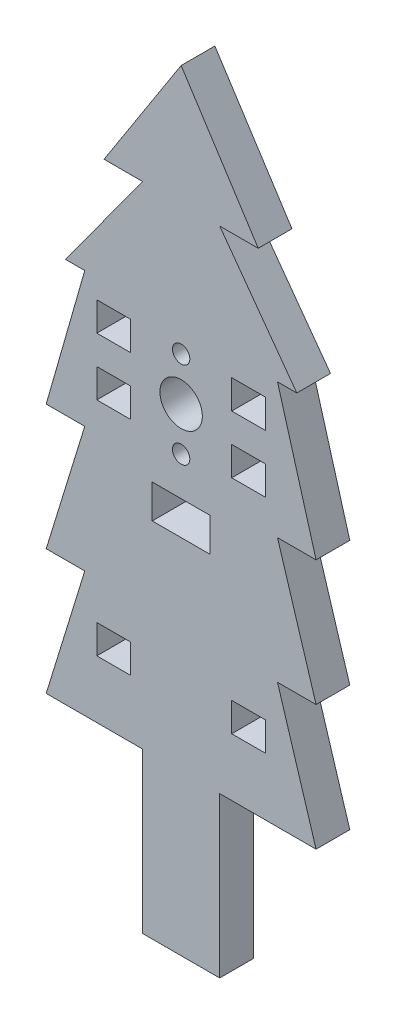
from build123d import *

# Parameters (mm, degrees)
PROFILE_LASER_PROFILE_3P5_R   = 2.2
PROFILE_LASER_PROFILE_3P5_R_2 = 0.9
PROFILE_LASER_PROFILE_3P5_W   = 3.5
PROFILE_LASER_PROFILE_3P5_H   = 3
PROFILE_LASER_PROFILE_3P5_W_2 = 6
PROFILE_LASER_PROFILE_3P5_H_2 = 3.5
LASER_PROFILE_3P5_DEPTH       = 3.5


with BuildPart() as part:
    # Profile_Laser_profile_3p5 → Laser_profile_3p5 (new body)
    with BuildSketch(Plane.XY):
        Polygon((0, 30.427227289), (8, 18), (4, 18), (12, 7), (10, 7), (14, -7), (10, -7), (14, -20), (10, -20), (14, -33), (4, -33), (4, -49.572772711), (-4, -49.572772711), (-4, -33), (-14, -33), (-10, -20), (-14, -20), (-10, -7), (-14, -7), (-10, 7), (-12, 7), (-4, 18), (-8, 18), align=None)
        Circle(PROFILE_LASER_PROFILE_3P5_R, mode=Mode.SUBTRACT)
        with Locations((0, -4.5)):
            Circle(PROFILE_LASER_PROFILE_3P5_R_2, mode=Mode.SUBTRACT)
        with Locations((0, 4.5)):
            Circle(PROFILE_LASER_PROFILE_3P5_R_2, mode=Mode.SUBTRACT)
        with Locations((-7, 3.5)):
            Rectangle(PROFILE_LASER_PROFILE_3P5_W, PROFILE_LASER_PROFILE_3P5_H, mode=Mode.SUBTRACT)
        with Locations((-7, -2.5)):
            Rectangle(PROFILE_LASER_PROFILE_3P5_W, PROFILE_LASER_PROFILE_3P5_H, mode=Mode.SUBTRACT)
        with Locations((-7, -25.5)):
            Rectangle(PROFILE_LASER_PROFILE_3P5_W, PROFILE_LASER_PROFILE_3P5_H, mode=Mode.SUBTRACT)
        with Locations((7, 3.5)):
            Rectangle(PROFILE_LASER_PROFILE_3P5_W, PROFILE_LASER_PROFILE_3P5_H, mode=Mode.SUBTRACT)
        with Locations((7, -2.5)):
            Rectangle(PROFILE_LASER_PROFILE_3P5_W, PROFILE_LASER_PROFILE_3P5_H, mode=Mode.SUBTRACT)
        with Locations((7, -25.5)):
            Rectangle(PROFILE_LASER_PROFILE_3P5_W, PROFILE_LASER_PROFILE_3P5_H, mode=Mode.SUBTRACT)
        with Locations((0, -10.25)):
            Rectangle(PROFILE_LASER_PROFILE_3P5_W_2, PROFILE_LASER_PROFILE_3P5_H_2, mode=Mode.SUBTRACT)
    extrude(amount=LASER_PROFILE_3P5_DEPTH)


solid = part.part
